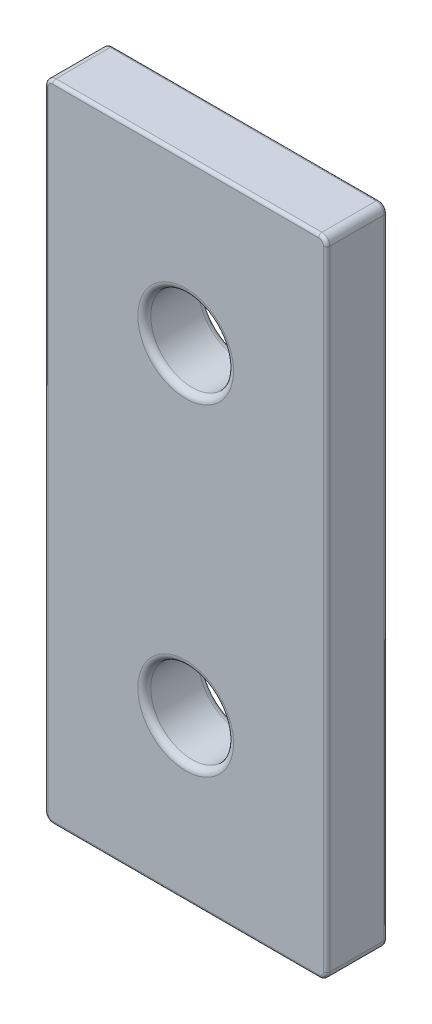
from build123d import *

# Parameters (mm, degrees)
BOSS_EXTRUDE1_START  = -2.3876
SKETCH3_W            = 22.225
SKETCH3_H            = 50.8
BOSS_EXTRUDE1_DEPTH  = 4.7752
FILLET1_R            = 0.635
SKETCH4_R            = 3.2639
CUT_EXTRUDE1_DEPTH   = 29.132724562
LPATTERN1_COUNT      = 2
LPATTERN1_PITCH      = 25.4
LPATTERN1_COUNT_DIR2 = 2
LPATTERN1_PITCH_DIR2 = 25.4
FILLET2_R            = 0.254
FILLET3_R            = 0.508


with BuildPart() as part:
    # Sketch3 → Boss-Extrude1 (new body)
    with BuildSketch(Plane.XY.offset(BOSS_EXTRUDE1_START)):
        Rectangle(SKETCH3_W, SKETCH3_H)
    extrude(amount=BOSS_EXTRUDE1_DEPTH)

    # Fillet1
    fillet1_edges = [part.edges().sort_by_distance(p)[0] for p in [
        (11.1125, 25.4, 0),
        (11.1125, -25.4, 0),
        (-11.1125, -25.4, 0),
        (-11.1125, 25.4, 0),
    ]]
    fillet(fillet1_edges, radius=FILLET1_R)

    # Sketch4 → Cut-Extrude1 (cut, through all)
    with BuildSketch(Plane.XY.offset(2.3876)):
        with Locations((0, 12.7)):
            Circle(SKETCH4_R)
    cut_extrude1 = extrude(amount=-CUT_EXTRUDE1_DEPTH, mode=Mode.SUBTRACT)

    # LPattern1: Cut-Extrude1 2 × 2
    with Locations(*[(-j * LPATTERN1_PITCH_DIR2, -i * LPATTERN1_PITCH, 0) for i in range(LPATTERN1_COUNT) for j in range(LPATTERN1_COUNT_DIR2) if (i, j) != (0, 0)]):
        add(cut_extrude1, mode=Mode.SUBTRACT)

    # Fillet2
    fillet2_edges = [part.edges().sort_by_distance(p)[0] for p in [
        (11.1125, 0, -2.3876),
        (11.1125, 0, 2.3876),
        (0, 25.4, -2.3876),
        (0, -25.4, -2.3876),
        (-11.1125, 0, -2.3876),
        (10.926512806, 25.214012806, -2.3876),
        (-10.926512806, 25.214012806, -2.3876),
        (-10.926512806, -25.214012806, -2.3876),
        (10.926512806, -25.214012806, -2.3876),
        (0, -25.4, 2.3876),
        (0, 25.4, 2.3876),
        (-11.1125, 0, 2.3876),
        (10.926512806, 25.214012806, 2.3876),
        (-10.926512806, 25.214012806, 2.3876),
        (-10.926512806, -25.214012806, 2.3876),
        (10.926512806, -25.214012806, 2.3876),
    ]]
    fillet(fillet2_edges, radius=FILLET2_R)

    # Fillet3
    fillet3_edges = [part.edges().sort_by_distance(p)[0] for p in [
        (-3.2639, 12.7, -2.3876),
        (-3.2639, 12.7, 2.3876),
        (-3.2639, -12.7, 2.3876),
        (-3.2639, -12.7, -2.3876),
    ]]
    fillet(fillet3_edges, radius=FILLET3_R)


solid = part.part
